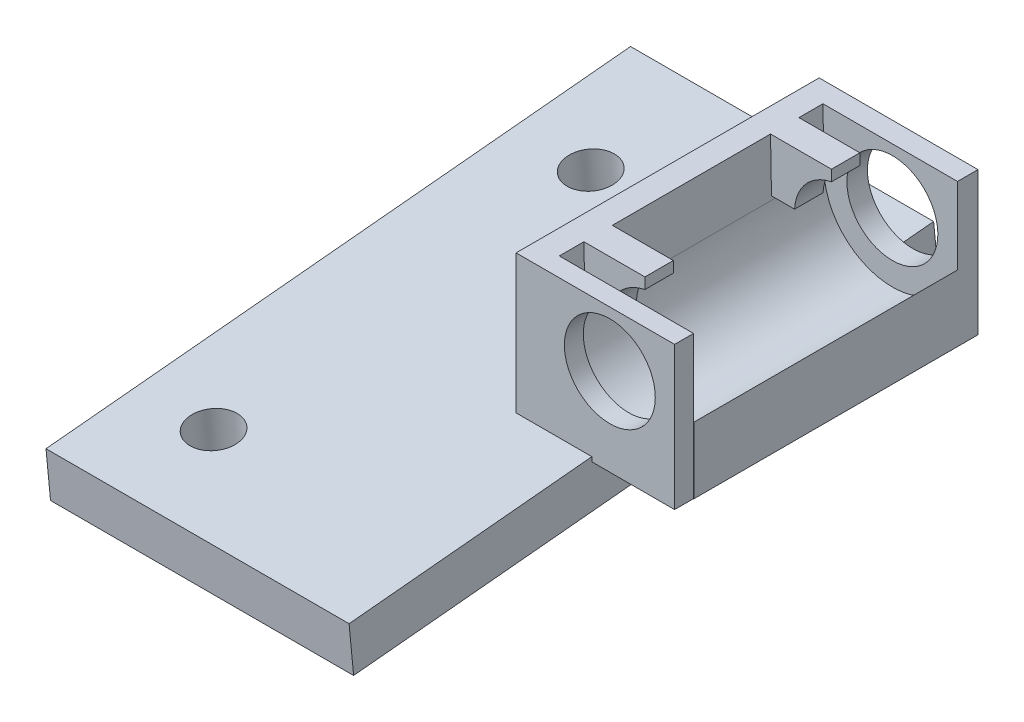
from build123d import *

# Parameters (mm, degrees)
BOSS_EXTRUDE1_DEPTH      = 38.1
SKETCH2_W                = 21.254408964
SKETCH2_H                = 19.186791326
SKETCH2_R                = 6.096
BOSS_EXTRUDE2_DEPTH      = 2.54
SKETCH3_W                = 21.299098627
SKETCH3_H                = 19.186791326
SKETCH3_R                = 6.096
BOSS_EXTRUDE3_DEPTH      = 2.75
SKETCH4_W                = 3.81
SKETCH4_H                = 7.112
BOSS_EXTRUDE4_DEPTH      = 11.43
CUT_EXTRUDE1_START       = -48.006
SKETCH5_R                = 6.096
CUT_EXTRUDE1_DEPTH       = 48.006
BOSS_EXTRUDE6_DEPTH      = 2.54
BOSS_EXTRUDE6_DEPTH_BACK = 3.81
SKETCH6_W                = 40.64
SKETCH6_H                = 78.74
SKETCH6_R                = 3.175
CUT_EXTRUDE4_DEPTH       = 14.986


with BuildPart() as part:
    # Sketch1 → Boss-Extrude1 (new body)
    with BuildSketch(Plane.XY):
        with BuildLine():
            Line((-215.570198928, 18.806934831), (-215.570198928, -0.379856495))
            Line((-215.570198928, -0.379856495), (-194.271100301, -0.379856495))
            Line((-194.271100301, -0.379856495), (-194.271100301, 8.523676101))
            ThreePointArc((-194.271100301, 8.523676101), (-204.346944245, 2.274200919), (-212.173440462, 11.180632763))
            Line((-212.173440462, 11.180632763), (-212.314070883, 18.806934831))
            Line((-212.314070883, 18.806934831), (-215.570198928, 18.806934831))
        make_face()
    extrude(amount=-BOSS_EXTRUDE1_DEPTH)

    # Sketch2 → Boss-Extrude2 (add)
    with BuildSketch(Plane.XY):
        with Locations((-204.942994446, 9.213539168)):
            Rectangle(SKETCH2_W, SKETCH2_H)
        with Locations((-203, 11.349792702)):
            Circle(SKETCH2_R, mode=Mode.SUBTRACT)
    extrude(amount=BOSS_EXTRUDE2_DEPTH)

    # Sketch3 → Boss-Extrude3 (add)
    with BuildSketch(Plane(origin=(0, 0, -38.1), x_dir=(-1, 0, 0), z_dir=(0, 0, -1))):
        with Locations((204.920649615, 9.213539168)):
            Rectangle(SKETCH3_W, SKETCH3_H)
        with Locations(Location((203, 11.349792702, 0), (0, 0, 180))):
            Circle(SKETCH3_R, mode=Mode.SUBTRACT)
    extrude(amount=-BOSS_EXTRUDE3_DEPTH)

    # Sketch4 → Boss-Extrude4 (add)
    with BuildSketch(Plane.ZY.offset(215.570198928)):
        with Locations((-30.226, 15.250934831)):
            Rectangle(SKETCH4_W, SKETCH4_H)
        with Locations((-5.207, 15.250934831)):
            Rectangle(SKETCH4_W, SKETCH4_H)
    extrude(amount=-BOSS_EXTRUDE4_DEPTH)

    # Sketch5 → Cut-Extrude1 (cut)
    with BuildSketch(Plane.XY.offset(2.54).offset(CUT_EXTRUDE1_START)):
        with Locations((-203, 11.349792702)):
            Circle(SKETCH5_R)
    extrude(amount=CUT_EXTRUDE1_DEPTH, mode=Mode.SUBTRACT)

    # Sketch6 → Boss-Extrude6 (add, two sides: drawn at the far end of the back side and taken through both)
    with BuildSketch(Plane(origin=(0, -2.065883606, -0.198109283), x_dir=(1, 0, 0), z_dir=(0, 0.9954334818448491, 0.09545775621834246)).offset(-BOSS_EXTRUDE6_DEPTH_BACK)):
        with Locations((-225.730198928, 4.161283459)):
            Rectangle(SKETCH6_W, SKETCH6_H)
        with Locations(Location((-235.857142857, 27.925906095, 0), (0, 0, 270))):
            Circle(SKETCH6_R, mode=Mode.SUBTRACT)
        with Locations(Location((-235.857142857, -22.874093905, 0), (0, 0, 270))):
            Circle(SKETCH6_R, mode=Mode.SUBTRACT)
    extrude(amount=BOSS_EXTRUDE6_DEPTH + BOSS_EXTRUDE6_DEPTH_BACK)

    # Sketch8 → Cut-Extrude4 (cut)
    with BuildSketch(Plane.XY.offset(-35.35)):
        with BuildLine():
            Line((-208.294707237, 3.856682515), (-206.618379139, 6.443822012))
            ThreePointArc((-206.618379139, 6.443822012), (-201.346524178, 5.482320187), (-197.352419837, 9.055004192))
            Line((-197.352419837, 9.055004192), (-194.271100301, 8.523676101))
            ThreePointArc((-194.271100301, 8.523676101), (-200.102824349, 2.644219875), (-208.294707237, 3.856682515))
        make_face()
    extrude(amount=CUT_EXTRUDE4_DEPTH, mode=Mode.SUBTRACT)


solid = part.part
